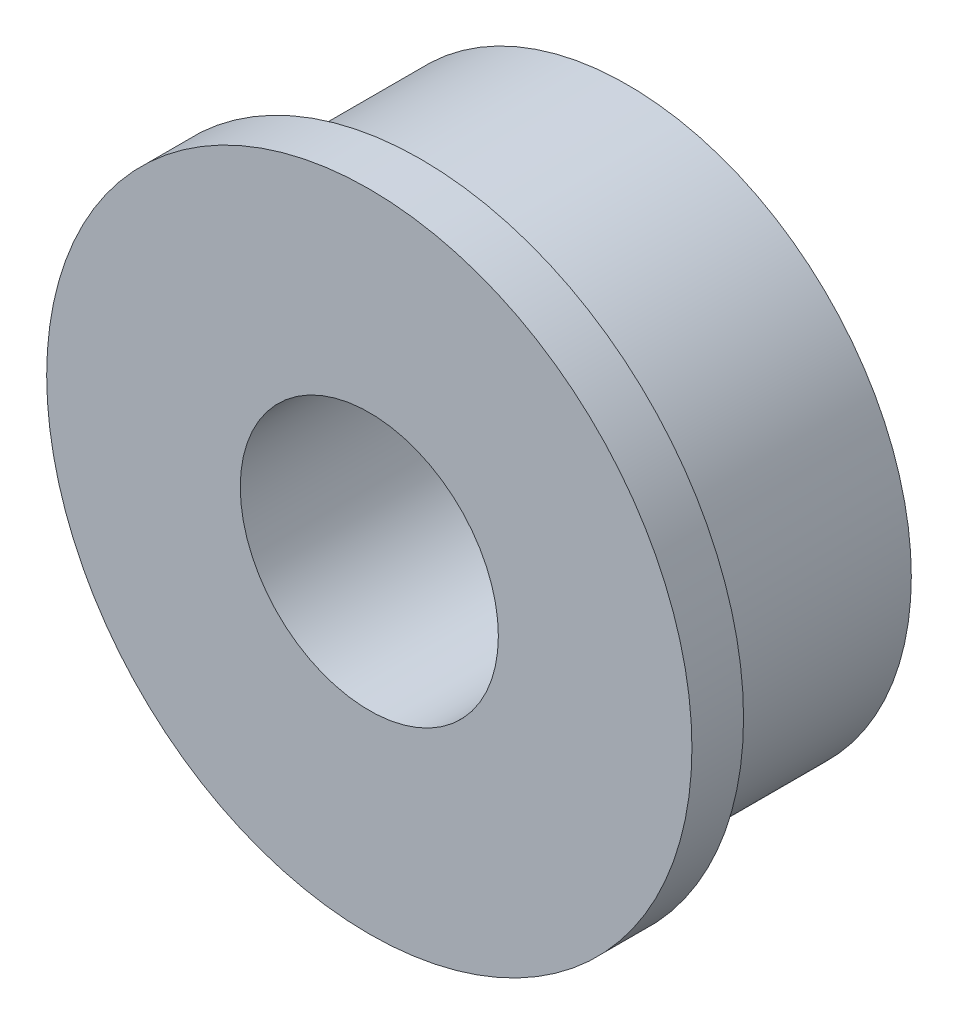
from build123d import *

# Parameters (mm, degrees)
SKETCH_1_R      = 5.5
SKETCH_1_R_2    = 2.5
EXTRUDE_1_DEPTH = 4
SKETCH_2_R      = 6.25
SKETCH_2_R_2    = 2.5
EXTRUDE_2_DEPTH = 1


with BuildPart() as part:
    # 草图1 → 凸台-拉伸1 (new body)
    with BuildSketch(Plane.XY):
        Circle(SKETCH_1_R)
        Circle(SKETCH_1_R_2, mode=Mode.SUBTRACT)
    extrude(amount=EXTRUDE_1_DEPTH)

    # 草图2 → 凸台-拉伸2 (add)
    with BuildSketch(Plane.XY.offset(4)):
        Circle(SKETCH_2_R)
        Circle(SKETCH_2_R_2, mode=Mode.SUBTRACT)
    extrude(amount=EXTRUDE_2_DEPTH)


solid = part.part
